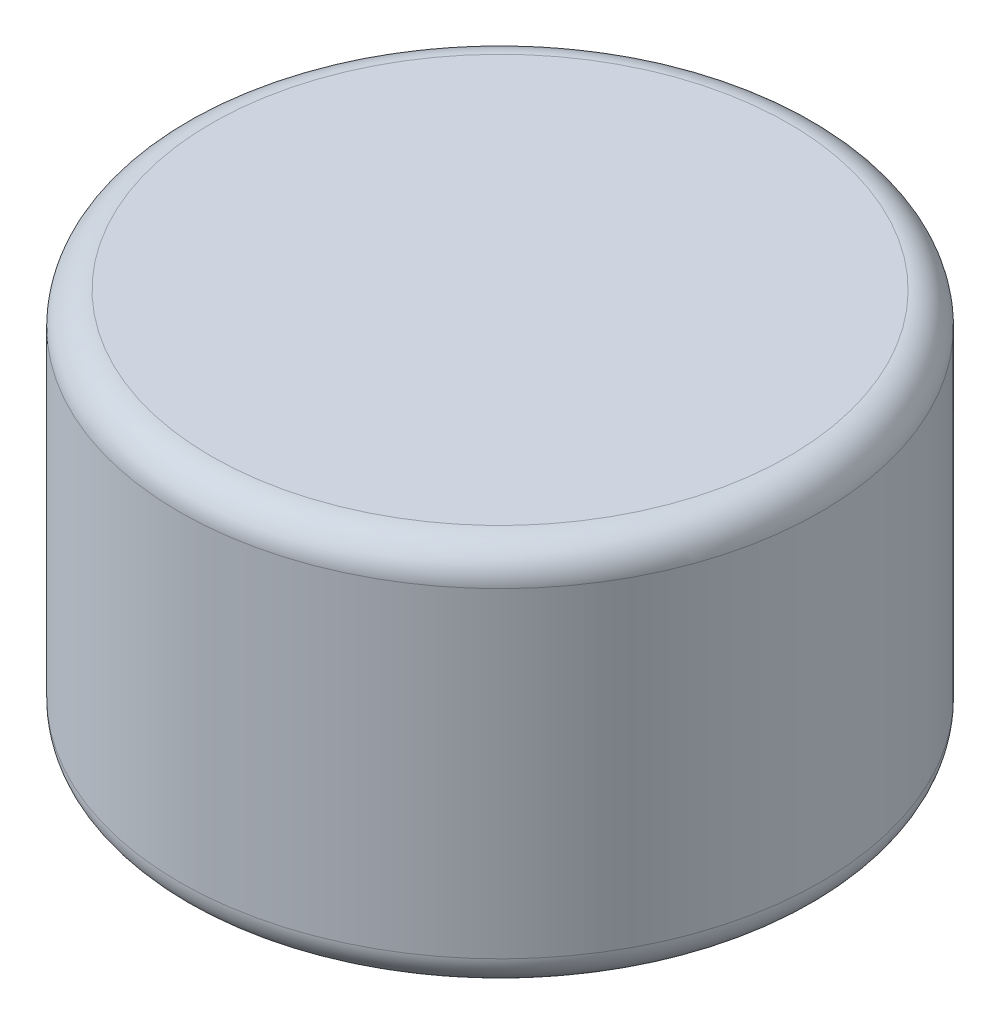
from build123d import *

# Parameters (mm, degrees)
SKETCH1_R           = 2.5
BOSS_EXTRUDE1_DEPTH = 3
FILLET1_R           = 0.25


with BuildPart() as part:
    # Sketch1 → Boss-Extrude1 (new body)
    with BuildSketch(Plane(origin=(0, 0, 0), x_dir=(1, 0, 0), z_dir=(0, 1, 0))):
        with Locations(Location((0, 0, 0), (0, 0, 270))):
            Circle(SKETCH1_R)
    extrude(amount=BOSS_EXTRUDE1_DEPTH)

    # Fillet1
    fillet1_edges = [part.edges().sort_by_distance(p)[0] for p in [
        (0, 0, -2.5),
        (0, 3, -2.5),
    ]]
    fillet(fillet1_edges, radius=FILLET1_R)


solid = part.part
